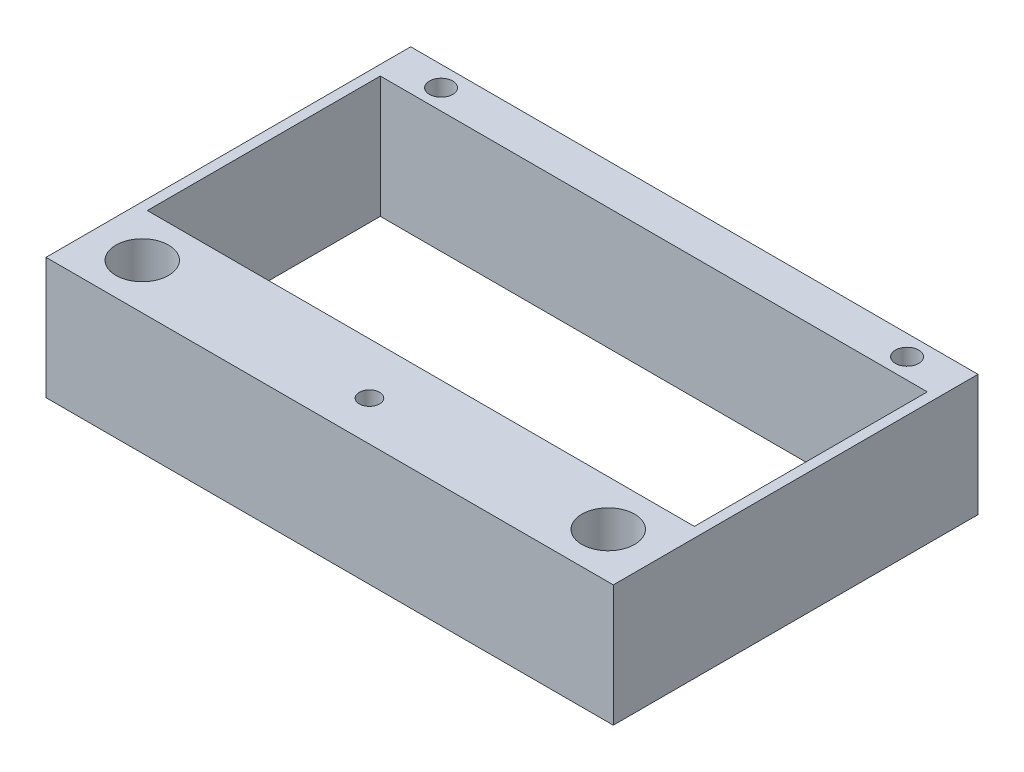
from build123d import *

# Parameters (mm, degrees)
EXTRUDE_1_DEPTH     = 12
SKETCH_4_W          = 56
SKETCH_4_H          = 3
SKETCH_4_H_2        = 1
EXTRUDE_2_DEPTH     = 12
SKETCH_5_R          = 1.15
SKETCH_5_R_2        = 2.6
CUT_EXTRUDE_2_DEPTH = 53.211370172
SKETCH_7_R          = 1
CUT_EXTRUDE_3_DEPTH = 10


with BuildPart() as part:
    # 草图2 → 凸台-拉伸1 (new body)
    with BuildSketch(Plane(origin=(0, 0, 0), x_dir=(1, 0, 0), z_dir=(0, 1, 0))):
        Polygon((-10.725663717, 9.92920354), (45.274336283, 9.92920354), (45.274336283, -22.07079646), (-10.725663717, -22.07079646), (-10.725663717, -7.07079646), (-10.725663717, 1.92920354), align=None)
        Polygon((-9.725663717, -7.07079646), (-9.725663717, -14.07079646), (44.274336283, -14.07079646), (44.274336283, 8.92920354), (-9.725663717, 8.92920354), (-9.725663717, 0.92920354), align=None, mode=Mode.SUBTRACT)
    extrude(amount=EXTRUDE_1_DEPTH)

    # 草图4 → 凸台-拉伸2 (add)
    with BuildSketch(Plane(origin=(0, 0, 0), x_dir=(1, 0, 0), z_dir=(0, 1, 0))):
        with Locations((17.274336283, 11.42920354)):
            Rectangle(SKETCH_4_W, SKETCH_4_H)
        with Locations((17.274336283, -22.57079646)):
            Rectangle(SKETCH_4_W, SKETCH_4_H_2)
    extrude(amount=EXTRUDE_2_DEPTH)

    # 草图5 → 切除-拉伸2 (cut, through all)
    with BuildSketch(Plane(origin=(0, 12, 0), x_dir=(1, 0, 0), z_dir=(0, 1, 0))):
        with Locations(Location((-5.725663717, 10.92920354, 0), (0, 0, 270))):
            Circle(SKETCH_5_R)
        with Locations(Location((40.274336283, 10.92920354, 0), (0, 0, 270))):
            Circle(SKETCH_5_R)
        with Locations(Location((-5.725663717, -18.57079646, 0), (0, 0, 270))):
            Circle(SKETCH_5_R_2)
        with Locations(Location((40.274336283, -18.57079646, 0), (0, 0, 270))):
            Circle(SKETCH_5_R_2)
    extrude(amount=-CUT_EXTRUDE_2_DEPTH, mode=Mode.SUBTRACT)

    # 草图7 → 切除-拉伸3 (cut)
    with BuildSketch(Plane(origin=(0, 12, 0), x_dir=(1, 0, 0), z_dir=(0, 1, 0))):
        with Locations(Location((17.274336283, -19.142973174, 0), (0, 0, 270))):
            Circle(SKETCH_7_R)
    extrude(amount=-CUT_EXTRUDE_3_DEPTH, mode=Mode.SUBTRACT)


solid = part.part
